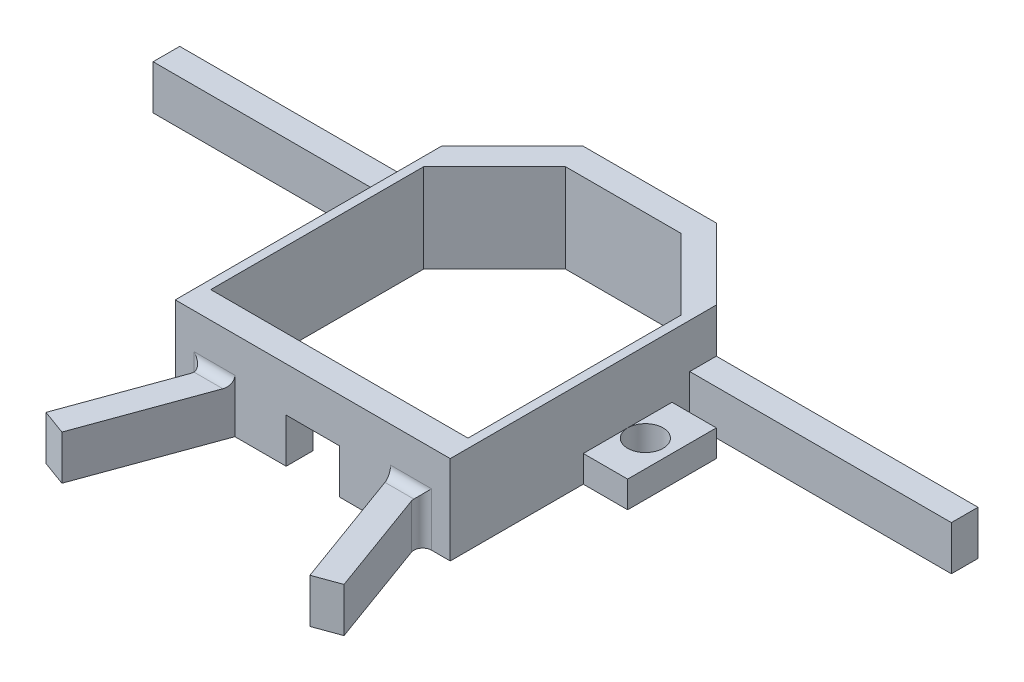
from build123d import *

# Parameters (mm, degrees)
SKETCH1_W            = 31
SKETCH1_H            = 38
SKETCH1_W_2          = 29
SKETCH1_H_2          = 32
BOSS_EXTRUDE1_DEPTH  = 10
SKETCH2_W            = 6
SKETCH2_H            = 10
SKETCH2_R            = 2
BOSS_EXTRUDE2_DEPTH  = 3
SKETCH3_W            = 6
SKETCH3_H            = 3
CUT_EXTRUDE1_DEPTH   = 5
SKETCH4_W            = 29.5
SKETCH4_H            = 3
BOSS_EXTRUDE3_DEPTH  = 5
FILLET1_R            = 1
CHAMFER1_SIZE        = 8
FILLET1_OF_MIRROR2_R = 1


with BuildPart() as part:
    # Sketch1 → Boss-Extrude1 (new body)
    with BuildSketch(Plane(origin=(0, 0, 0), x_dir=(1, 0, 0), z_dir=(0, 1, 0))):
        Rectangle(SKETCH1_W, SKETCH1_H)
        Rectangle(SKETCH1_W_2, SKETCH1_H_2, mode=Mode.SUBTRACT)
    extrude(amount=BOSS_EXTRUDE1_DEPTH)

    # Sketch2 → Boss-Extrude2 (add)
    with BuildSketch(Plane.XZ):
        with Locations((17.5, -1)):
            Rectangle(SKETCH2_W, SKETCH2_H)
        with Locations(Location((17.5, -1, 0), (0, 0, 270))):
            Circle(SKETCH2_R, mode=Mode.SUBTRACT)
    boss_extrude2 = extrude(amount=-BOSS_EXTRUDE2_DEPTH)

    # Mirror1: Boss-Extrude2 across plane
    add(boss_extrude2.mirror(Plane(origin=(0, 0, 0), x_dir=(0, 0, 1), z_dir=(1, 0, 0))))

    # Sketch3 → Cut-Extrude1 (cut)
    with BuildSketch(Plane.XZ):
        with Locations((0, 17.5)):
            Rectangle(SKETCH3_W, SKETCH3_H)
    extrude(amount=-CUT_EXTRUDE1_DEPTH, mode=Mode.SUBTRACT)

    # Sketch4 → Boss-Extrude3 (add)
    with BuildSketch(Plane.XZ):
        Polygon((13.981367518, 33.29919815), (16.800445381, 32.27313772), (11.969418335, 19), (8.776885018, 19), align=None)
        with Locations((30.25, -9.5)):
            Rectangle(SKETCH4_W, SKETCH4_H)
    boss_extrude3 = extrude(amount=-BOSS_EXTRUDE3_DEPTH)

    # Fillet1
    fillet1_edges = [part.edges().sort_by_distance(p)[0] for p in [
        (10.373151677, 5, 19),
        (11.969418335, 2.5, 19),
    ]]
    fillet(fillet1_edges, radius=FILLET1_R)

    # Chamfer1
    chamfer1_edges = [part.edges().sort_by_distance(p)[0] for p in [
        (15.5, 5, -19),
        (-15.5, 5, -19),
        (14.5, 5, -16),
        (-14.5, 5, -16),
    ]]
    chamfer(chamfer1_edges, length=CHAMFER1_SIZE)

    # Mirror2: Boss-Extrude3 across plane
    add(boss_extrude3.mirror(Plane(origin=(0, 0, 0), x_dir=(0, 0, 1), z_dir=(1, 0, 0))))

    # Fillet1 of Mirror2
    fillet1_of_mirror2_edges = [part.edges().sort_by_distance(p)[0] for p in [
        (-10.373151677, 5, 19),
        (-11.969418335, 2.5, 19),
    ]]
    fillet(fillet1_of_mirror2_edges, radius=FILLET1_OF_MIRROR2_R)


solid = part.part
